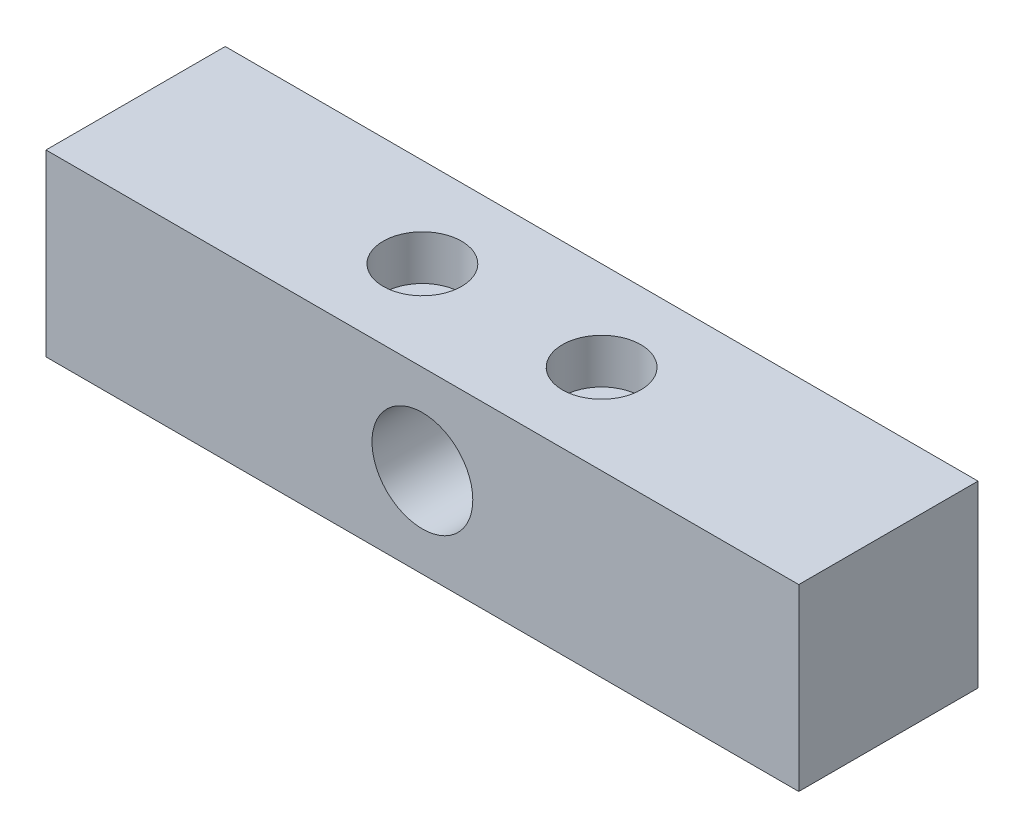
from build123d import *

# Parameters (mm, degrees)
SKETCH1_W                                            = 106.68
SKETCH1_H                                            = 25.4
BOSS_EXTRUDE1_DEPTH                                  = 25.4
SKETCH1_3_R                                          = 8.128
CUT_EXTRUDE1_DEPTH                                   = 19.05
CBORE_FOR_1_4_BINDING_HEAD_MACHINE_SCREW_D           = 6.7564
CBORE_FOR_1_4_BINDING_HEAD_MACHINE_SCREW_CBORE_D     = 14.2875
CBORE_FOR_1_4_BINDING_HEAD_MACHINE_SCREW_CBORE_DEPTH = 19.05
CBORE_FOR_1_4_SOCKET_HEAD_CAP_SCREW1_D               = 6.7564
CBORE_FOR_1_4_SOCKET_HEAD_CAP_SCREW1_CBORE_D         = 11.1125
CBORE_FOR_1_4_SOCKET_HEAD_CAP_SCREW1_CBORE_DEPTH     = 6.35


with BuildPart() as part:
    # Sketch1 → Boss-Extrude1 (new body)
    with BuildSketch(Plane.XY):
        Rectangle(SKETCH1_W, SKETCH1_H)
    extrude(amount=BOSS_EXTRUDE1_DEPTH)

    # Sketch1<3> → Cut-Extrude1 (cut)
    with BuildSketch(Plane.XY):
        with Locations(Location((-38.1, 0, 0), (0, 0, 180))):
            Circle(SKETCH1_3_R)
        with Locations(Location((38.1, 0, 0), (0, 0, 180))):
            Circle(SKETCH1_3_R)
    extrude(amount=CUT_EXTRUDE1_DEPTH, mode=Mode.SUBTRACT)

    # CBORE for 1/4 Binding Head Machine Screw1 (through all)
    with Locations(Plane.XY.offset(25.4)):
        with Locations((0, 0)):
            CounterBoreHole(CBORE_FOR_1_4_BINDING_HEAD_MACHINE_SCREW_D / 2, CBORE_FOR_1_4_BINDING_HEAD_MACHINE_SCREW_CBORE_D / 2, CBORE_FOR_1_4_BINDING_HEAD_MACHINE_SCREW_CBORE_DEPTH)

    # CBORE for 1/4 Socket Head Cap Screw1 (through all)
    with Locations(Plane(origin=(0, 12.7, 0), x_dir=(1, 0, 0), z_dir=(0, 1, 0))):
        with Locations((12.7, -12.7), (-12.7, -12.7)):
            CounterBoreHole(CBORE_FOR_1_4_SOCKET_HEAD_CAP_SCREW1_D / 2, CBORE_FOR_1_4_SOCKET_HEAD_CAP_SCREW1_CBORE_D / 2, CBORE_FOR_1_4_SOCKET_HEAD_CAP_SCREW1_CBORE_DEPTH)


solid = part.part
